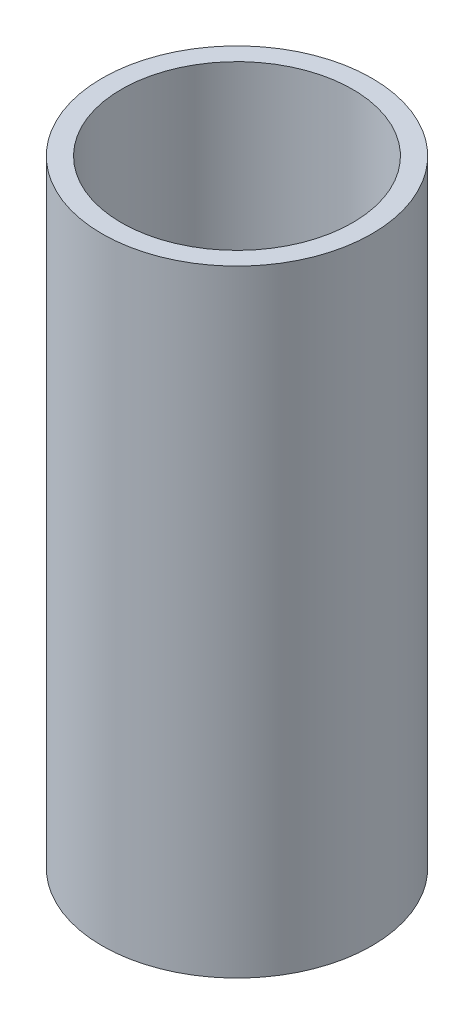
from build123d import *

# Parameters (mm, degrees)
SKETCH1_R           = 44.45
SKETCH1_R_2         = 38.1
BOSS_EXTRUDE1_DEPTH = 203.2


with BuildPart() as part:
    # Sketch1 → Boss-Extrude1 (new body)
    with BuildSketch(Plane(origin=(0, 0, 0), x_dir=(1, 0, 0), z_dir=(0, 1, 0))):
        with Locations(Location((0, 0, 0), (0, 0, 270))):
            Circle(SKETCH1_R)
        with Locations(Location((0, 0, 0), (0, 0, 270))):
            Circle(SKETCH1_R_2, mode=Mode.SUBTRACT)
    extrude(amount=BOSS_EXTRUDE1_DEPTH)


solid = part.part
